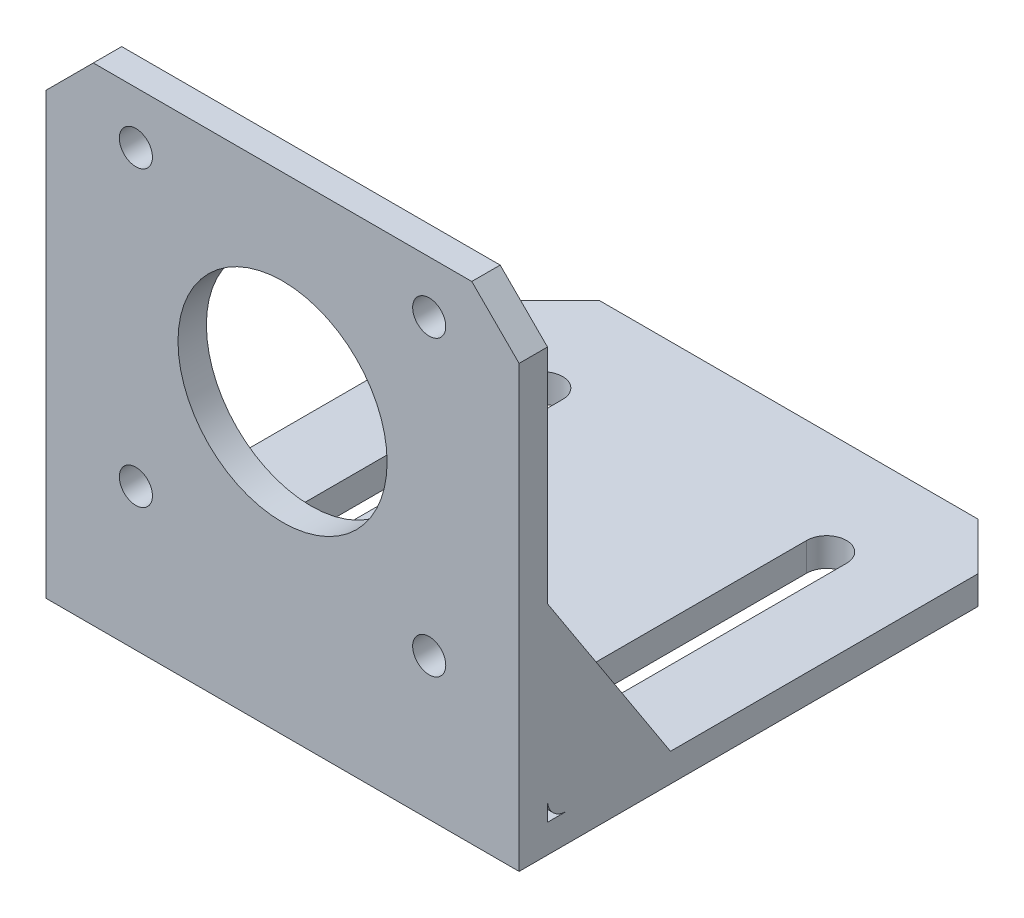
from build123d import *

# Parameters (mm, degrees)
EXTRUDE_1_DEPTH     = 50
SKETCH_2_R          = 11.05
CUT_EXTRUDE_1_DEPTH = 88.76388779
CHAMFER_1_SIZE      = 5
SKETCH_3_R          = 1.75
CUT_EXTRUDE_2_DEPTH = 88.76388779
EXTRUDE_3_DEPTH     = 3
EXTRUDE_START       = -3
EXTRUDE_4_DEPTH     = 3
CUT_EXTRUDE_3_DEPTH = 88.832226432


with BuildPart() as part:
    # 草图1 → 凸台-拉伸1 (new body)
    with BuildSketch(Plane(origin=(0, 0, 0), x_dir=(0, 0, -1), z_dir=(1, 0, 0))):
        Polygon((0, 0), (3, 0), (3, -48.5), (53.5, -48.5), (53.5, -51.5), (0, -51.5), align=None)
    extrude(amount=EXTRUDE_1_DEPTH)

    # 草图2 → 切除-拉伸1 (cut, through all)
    with BuildSketch(Plane(origin=(0, 0, -3), x_dir=(-1, 0, 0), z_dir=(0, 0, -1))):
        with Locations(Location((-25, -21, 0), (0, 0, 90))):
            Circle(SKETCH_2_R)
    extrude(amount=-CUT_EXTRUDE_1_DEPTH, mode=Mode.SUBTRACT)

    # 倒角1
    chamfer_1_edges = [part.edges().sort_by_distance(p)[0] for p in [
        (50, -50, -53.5),
        (50, 0, -1.5),
        (0, 0, -1.5),
        (0, -50, -53.5),
    ]]
    chamfer(chamfer_1_edges, length=CHAMFER_1_SIZE)

    # 草图3 → 切除-拉伸2 (cut, through all)
    with BuildSketch(Plane(origin=(0, 0, -3), x_dir=(-1, 0, 0), z_dir=(0, 0, -1))):
        with Locations(Location((-40.5, -5.5, 0), (0, 0, 90))):
            Circle(SKETCH_3_R)
        with Locations(Location((-9.5, -5.5, 0), (0, 0, 90))):
            Circle(SKETCH_3_R)
        with Locations(Location((-9.5, -36.5, 0), (0, 0, 90))):
            Circle(SKETCH_3_R)
        with Locations(Location((-40.5, -36.5, 0), (0, 0, 90))):
            Circle(SKETCH_3_R)
    extrude(amount=-CUT_EXTRUDE_2_DEPTH, mode=Mode.SUBTRACT)

    # 草图4 → 凸台-拉伸3 (add)
    with BuildSketch(Plane(origin=(50, 0, 0), x_dir=(0, 0, -1), z_dir=(1, 0, 0))):
        with BuildLine():
            Line((3, -28.5), (16, -48.5))
            Line((16, -48.5), (5, -48.5))
            ThreePointArc((5, -48.5), (3.585786438, -47.914213562), (3, -46.5))
            Line((3, -46.5), (3, -28.5))
        make_face()
    extrude(amount=-EXTRUDE_3_DEPTH)

    # 草图5 → 凸台-拉伸4 (add)
    with BuildSketch(Plane.ZY.offset(EXTRUDE_START)):
        with BuildLine():
            Line((-5, -48.5), (-16, -48.5))
            Line((-16, -48.5), (-3, -28.5))
            Line((-3, -28.5), (-3, -46.5))
            ThreePointArc((-3, -46.5), (-3.585786438, -47.914213562), (-5, -48.5))
        make_face()
    extrude(amount=EXTRUDE_4_DEPTH)

    # 草图6 → 切除-拉伸3 (cut, through all)
    with BuildSketch(Plane(origin=(0, -48.5, 0), x_dir=(1, 0, 0), z_dir=(0, 1, 0))):
        with BuildLine():
            Line((12.1, 42.5), (12.1, 12.5))
            ThreePointArc((12.1, 12.5), (10, 10.4), (7.9, 12.5))
            Line((7.9, 12.5), (7.9, 42.5))
            ThreePointArc((7.9, 42.5), (10, 44.6), (12.1, 42.5))
        make_face()
        with BuildLine():
            Line((42.1, 42.5), (42.1, 12.5))
            ThreePointArc((42.1, 12.5), (40, 10.4), (37.9, 12.5))
            Line((37.9, 12.5), (37.9, 42.5))
            ThreePointArc((37.9, 42.5), (40, 44.6), (42.1, 42.5))
        make_face()
    extrude(amount=-CUT_EXTRUDE_3_DEPTH, mode=Mode.SUBTRACT)


solid = part.part
